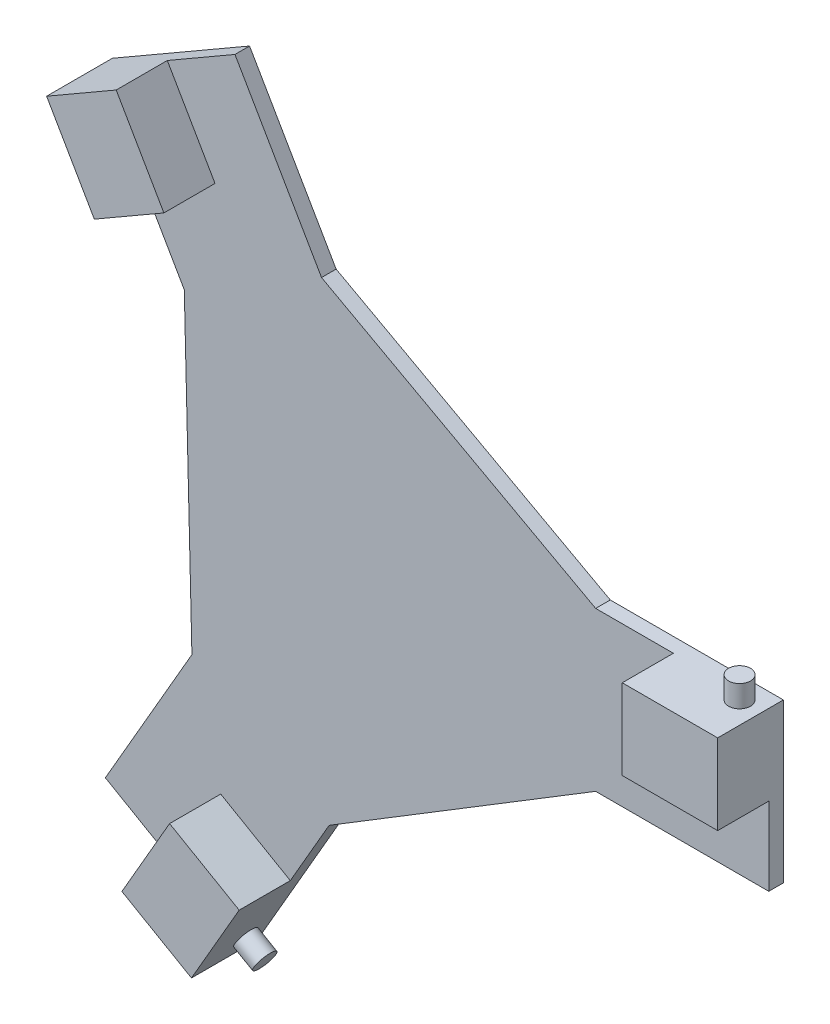
from build123d import *

# Parameters (mm, degrees)
BOSS_EXTRUDE1_DEPTH = 2
SKETCH2_W           = 6.854235104
SKETCH2_H           = 13.064732657
BOSS_EXTRUDE2_DEPTH = 11
SKETCH3_W           = 13.064732657
SKETCH3_H           = 11
BOSS_EXTRUDE3_DEPTH = 7
SKETCH6_R           = 1.5
BOSS_EXTRUDE4_DEPTH = 3
SKETCH7_R           = 1.5
BOSS_EXTRUDE5_DEPTH = 3
SKETCH8_R           = 1.5
BOSS_EXTRUDE6_DEPTH = 3


with BuildPart() as part:
    # Sketch1 → Boss-Extrude1 (new body)
    with BuildSketch(Plane.XY):
        Polygon((30.93899215, 11.451445147), (54.645492629, 11.451445147), (54.645492629, -10.246029868), (30.93899215, -10.246029868), (-5.552253668, -32.519675743), (-17.405503908, -53.050107393), (-36.196068468, -42.201369885), (-24.342818229, -21.670938236), (-25.386738482, 21.068230596), (-37.239988722, 41.598662246), (-18.449424161, 52.447399753), (-6.596173922, 31.916968104), align=None)
    extrude(amount=BOSS_EXTRUDE1_DEPTH)

    # Sketch2 → Boss-Extrude2 (add)
    with BuildSketch(Plane(origin=(-9.917242407, -5.725722573, 0), x_dir=(0, 0, 1), z_dir=(-0.8660254037844431, -0.4999999999999922, 0))):
        with Locations((5.427117552, 48.1131263)):
            Rectangle(SKETCH2_W, SKETCH2_H)
    extrude(amount=-BOSS_EXTRUDE2_DEPTH)

    # Sketch3 → Boss-Extrude3 (add)
    with BuildSketch(Plane.XY.offset(2)):
        Polygon((-37.239988722, 41.598662246), (-27.71370928, 47.098662246), (-21.181342951, 35.784271871), (-30.707622393, 30.284271871), align=None)
        with Locations((48.1131263, 5.951445147)):
            Rectangle(SKETCH3_W, SKETCH3_H)
        Polygon((-10.873137579, -41.735717017), (-17.405503908, -53.050107393), (-26.931783349, -47.550107393), (-20.39941702, -36.235717017), align=None)
    extrude(amount=BOSS_EXTRUDE3_DEPTH)

    # Sketch6 → Boss-Extrude4 (add)
    with BuildSketch(Plane(origin=(-9.917242407, -5.725722573, 0), x_dir=(0, 0, 1), z_dir=(-0.8660254037844431, -0.4999999999999922, 0))):
        with Locations(Location((3, 51.645492629, 0), (0, 0, 270))):
            Circle(SKETCH6_R)
    extrude(amount=BOSS_EXTRUDE4_DEPTH)

    # Sketch7 → Boss-Extrude5 (add)
    with BuildSketch(Plane(origin=(9.917242407, -5.725722573, 0), x_dir=(0, 0, -1), z_dir=(0.8660254037844364, -0.5000000000000041, 0))):
        with Locations(Location((-3.057556163, -51.645492629, 0), (0, 0, 90))):
            Circle(SKETCH7_R)
    extrude(amount=BOSS_EXTRUDE5_DEPTH)

    # Sketch8 → Boss-Extrude6 (add)
    with BuildSketch(Plane(origin=(0, 11.451445147, 0), x_dir=(1, 0, 0), z_dir=(0, 1, 0))):
        with Locations(Location((51.645492629, -3, 0), (0, 0, 270))):
            Circle(SKETCH8_R)
    extrude(amount=BOSS_EXTRUDE6_DEPTH)


solid = part.part
